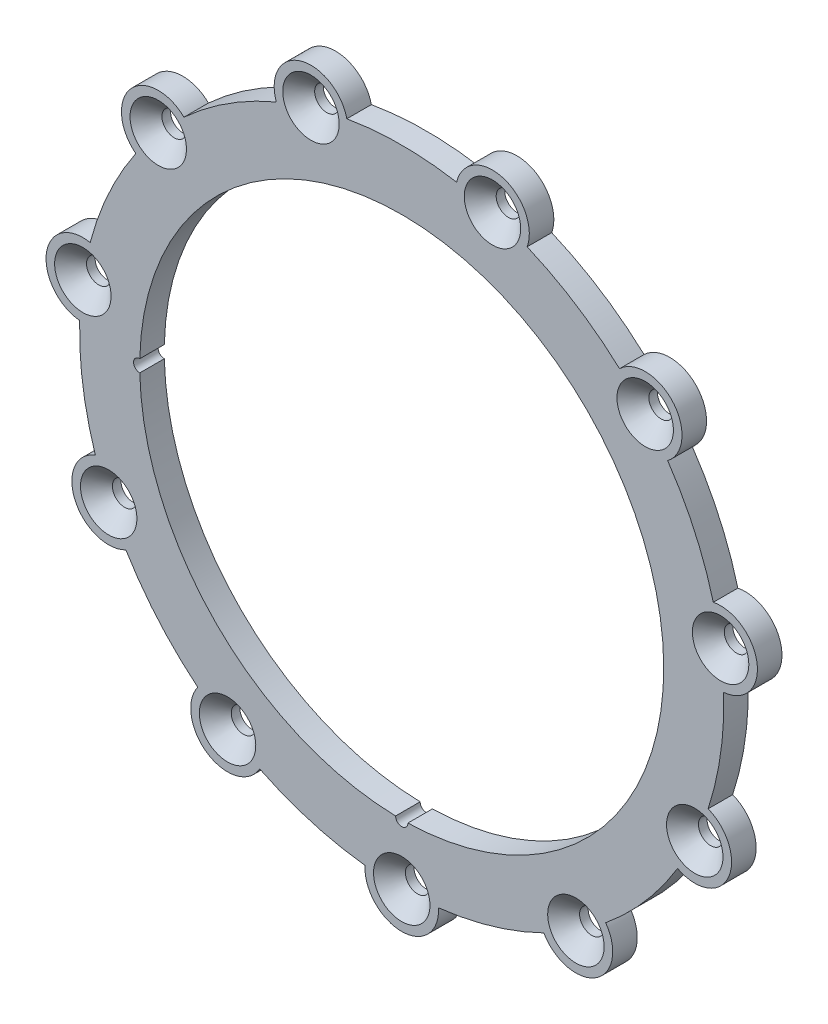
from build123d import *

# Parameters (mm, degrees)
SKETCH_1_R               = 42.7
SKETCH_1_R_2             = 2
EXTRUDE_1_DEPTH          = 4
SKETCH_2_R               = 1
CUT_EXTRUDE_1_DEPTH      = 4
PATTERN_CIRCULAR_1_COUNT = 11


with BuildPart() as part:
    # 草图1 → 凸台-拉伸1 (new body)
    with BuildSketch(Plane.XY):
        with BuildLine():
            ThreePointArc((-57.90455435, 8.325418039), (-56.664135325, 3.740040393), (-52.478752132, 1.493510837))
            ThreePointArc((-52.478752132, 1.493510837), (-51.965625699, -7.471529009), (-49.932223308, -16.217986173))
            ThreePointArc((-49.932223308, -16.217986173), (-53.315148558, -19.552674205), (-53.213471728, -24.301778261))
            ThreePointArc((-53.213471728, -24.301778261), (-49.690922522, -27.488622249), (-44.95538855, -27.115734184))
            ThreePointArc((-44.95538855, -27.115734184), (-39.676852654, -34.380188532), (-33.237553958, -40.63883619))
            ThreePointArc((-33.237553958, -40.63883619), (-34.280583312, -45.27310175), (-31.627487821, -49.213331671))
            ThreePointArc((-31.627487821, -49.213331671), (-26.941192918, -49.989841552), (-23.159006743, -47.115925192))
            ThreePointArc((-23.159006743, -47.115925192), (-14.790959234, -50.373381115), (-5.990196072, -52.157142857))
            ThreePointArc((-5.990196072, -52.157142857), (-4.36217508, -56.619639374), (0, -58.5))
            ThreePointArc((0, -58.5), (4.36217508, -56.619639374), (5.990196072, -52.157142857))
            ThreePointArc((5.990196072, -52.157142857), (14.790959234, -50.373381115), (23.159006743, -47.115925192))
            ThreePointArc((23.159006743, -47.115925192), (26.941192918, -49.989841552), (31.627487821, -49.213331671))
            ThreePointArc((31.627487821, -49.213331671), (34.280583312, -45.27310175), (33.237553958, -40.63883619))
            ThreePointArc((33.237553958, -40.63883619), (39.676852654, -34.380188532), (44.95538855, -27.115734184))
            ThreePointArc((44.95538855, -27.115734184), (49.690922522, -27.488622249), (53.213471728, -24.301778261))
            ThreePointArc((53.213471728, -24.301778261), (53.315148558, -19.552674205), (49.932223308, -16.217986173))
            ThreePointArc((49.932223308, -16.217986173), (51.965625699, -7.471529009), (52.478752132, 1.493510837))
            ThreePointArc((52.478752132, 1.493510837), (56.664135325, 3.740040393), (57.90455435, 8.325418039))
            ThreePointArc((57.90455435, 8.325418039), (55.422530843, 12.375589248), (50.773764562, 13.351959864))
            ThreePointArc((50.773764562, 13.351959864), (47.755679756, 21.809288183), (43.34048271, 29.62857672))
            ThreePointArc((43.34048271, 29.62857672), (45.646885531, 33.781266636), (44.2113501, 38.309352936))
            ThreePointArc((44.2113501, 38.309352936), (39.933651182, 40.374690556), (35.494994318, 38.682752984))
            ThreePointArc((35.494994318, 38.682752984), (28.383642916, 44.165810474), (20.441916256, 48.35677884))
            ThreePointArc((20.441916256, 48.35677884), (20.137072107, 53.097179409), (16.481354575, 56.130338956))
            ThreePointArc((16.481354575, 56.130338956), (11.766119429, 55.555112887), (8.946814173, 51.732045351))
            ThreePointArc((8.946814173, 51.732045351), (0, 52.5), (-8.946814173, 51.732045351))
            ThreePointArc((-8.946814173, 51.732045351), (-11.766119429, 55.555112887), (-16.481354575, 56.130338956))
            ThreePointArc((-16.481354575, 56.130338956), (-20.137072107, 53.097179409), (-20.441916256, 48.35677884))
            ThreePointArc((-20.441916256, 48.35677884), (-28.383642916, 44.165810474), (-35.494994318, 38.682752984))
            ThreePointArc((-35.494994318, 38.682752984), (-39.933651182, 40.374690556), (-44.2113501, 38.309352936))
            ThreePointArc((-44.2113501, 38.309352936), (-45.646885531, 33.781266636), (-43.34048271, 29.62857672))
            ThreePointArc((-43.34048271, 29.62857672), (-47.755679756, 21.809288183), (-50.773764562, 13.351959864))
            ThreePointArc((-50.773764562, 13.351959864), (-55.422530843, 12.375589248), (-57.90455435, 8.325418039))
        make_face()
        Circle(SKETCH_1_R, mode=Mode.SUBTRACT)
        with Locations((-51.965625699, 7.471529009)):
            Circle(SKETCH_1_R_2, mode=Mode.SUBTRACT)
        with Locations((-39.676852654, 34.380188532)):
            Circle(SKETCH_1_R_2, mode=Mode.SUBTRACT)
        with Locations((-14.790959234, 50.373381115)):
            Circle(SKETCH_1_R_2, mode=Mode.SUBTRACT)
        with Locations((14.790959234, 50.373381115)):
            Circle(SKETCH_1_R_2, mode=Mode.SUBTRACT)
        with Locations((39.676852654, 34.380188532)):
            Circle(SKETCH_1_R_2, mode=Mode.SUBTRACT)
        with Locations((51.965625699, 7.471529009)):
            Circle(SKETCH_1_R_2, mode=Mode.SUBTRACT)
        with Locations((47.755679756, -21.809288183)):
            Circle(SKETCH_1_R_2, mode=Mode.SUBTRACT)
        with Locations((28.383642916, -44.165810474)):
            Circle(SKETCH_1_R_2, mode=Mode.SUBTRACT)
        with Locations((0, -52.5)):
            Circle(SKETCH_1_R_2, mode=Mode.SUBTRACT)
        with Locations((-28.383642916, -44.165810474)):
            Circle(SKETCH_1_R_2, mode=Mode.SUBTRACT)
        with Locations((-47.755679756, -21.809288183)):
            Circle(SKETCH_1_R_2, mode=Mode.SUBTRACT)
    extrude(amount=EXTRUDE_1_DEPTH)

    # 草图2 → 切除-拉伸1 (cut)
    with BuildSketch(Plane.XY.offset(4)):
        with Locations((0, -42.7)):
            Circle(SKETCH_2_R)
        with Locations((-42.7, 0)):
            Circle(SKETCH_2_R)
    extrude(amount=-CUT_EXTRUDE_1_DEPTH, mode=Mode.SUBTRACT)

    # 草图4 → 切除-旋转1 (revolve, cut)
    with BuildSketch(Plane(origin=(0, 0, 0), x_dir=(0, 0, -1), z_dir=(1, 0, 0)), mode=Mode.PRIVATE) as cut_revolve_1_sk:
        Polygon((-4, -52.5), (-4, -57.1), (-1.4, -54.5), (-1.4, -52.5), align=None)
    cut_revolve_1 = revolve(cut_revolve_1_sk.sketch.rotate(Axis((0, -52.5, 4), (0, 0, -1)), 270), axis=Axis((0, -52.5, 4), (0, 0, -1)), mode=Mode.SUBTRACT)

    # 阵列(圆周)1: 切除-旋转1 ×11 about axis
    pattern_circular_1_axis = Axis((0, 0, 0), (0, 0, 1))
    for i in range(1, PATTERN_CIRCULAR_1_COUNT):
        add(cut_revolve_1.rotate(pattern_circular_1_axis, i * 360 / PATTERN_CIRCULAR_1_COUNT), mode=Mode.SUBTRACT)


solid = part.part
